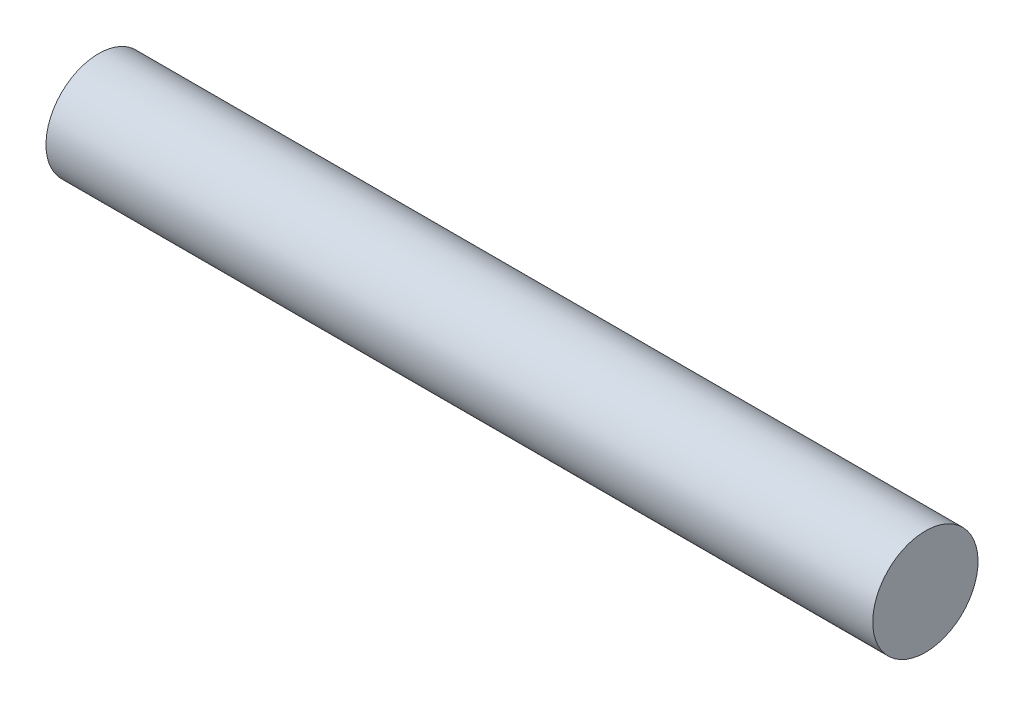
from build123d import *

# Parameters (mm, degrees)
SKETCH1_R           = 3.57
BOSS_EXTRUDE1_DEPTH = 56.076975759


with BuildPart() as part:
    # Sketch1 → Boss-Extrude1 (new body)
    with BuildSketch(Plane(origin=(0, 0, 0), x_dir=(0, 0, -1), z_dir=(1, 0, 0))):
        with Locations(Location((0, 0, 0), (0, 0, 270))):
            Circle(SKETCH1_R)
    extrude(amount=BOSS_EXTRUDE1_DEPTH)


solid = part.part
